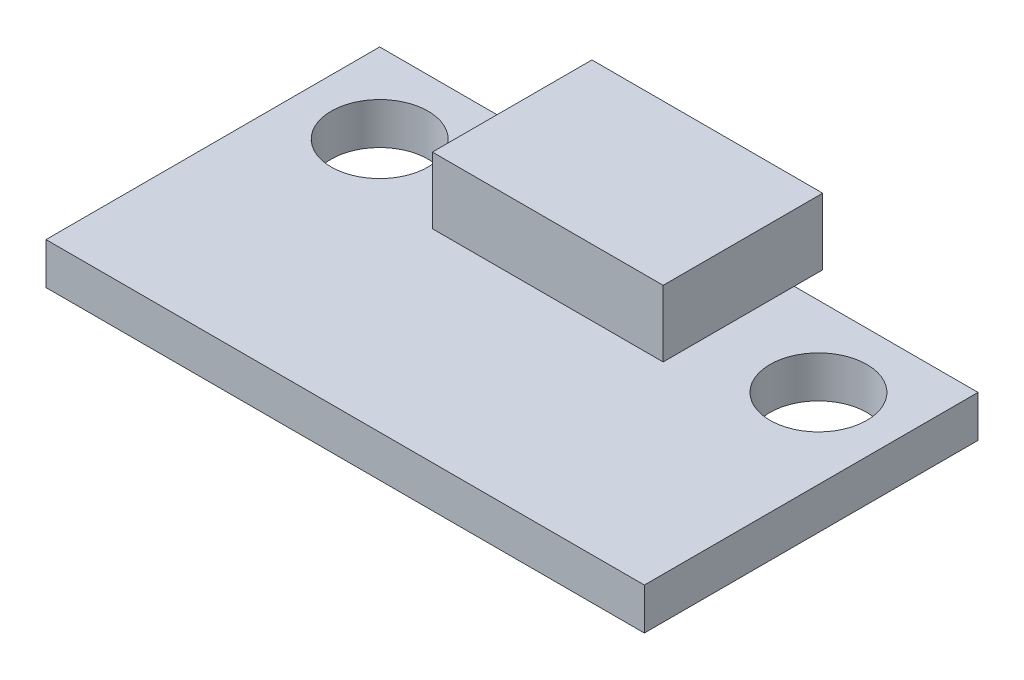
from build123d import *

# Parameters (mm, degrees)
SKETCH1_W           = 21
SKETCH1_H           = 11.71
SKETCH1_R           = 1.7
BOSS_EXTRUDE1_DEPTH = 1.46
SKETCH2_W           = 8.1
SKETCH2_H           = 5.6
BOSS_EXTRUDE2_DEPTH = 2.33


with BuildPart() as part:
    # Sketch1 → Boss-Extrude1 (new body)
    with BuildSketch(Plane(origin=(0, 0, 0), x_dir=(1, 0, 0), z_dir=(0, 1, 0))):
        Rectangle(SKETCH1_W, SKETCH1_H)
        with Locations(Location((-7.7, 3.055, 0), (0, 0, 270))):
            Circle(SKETCH1_R, mode=Mode.SUBTRACT)
        with Locations(Location((7.7, 3.055, 0), (0, 0, 90))):
            Circle(SKETCH1_R, mode=Mode.SUBTRACT)
    extrude(amount=BOSS_EXTRUDE1_DEPTH)

    # Sketch2 → Boss-Extrude2 (add)
    with BuildSketch(Plane(origin=(0, 1.46, 0), x_dir=(1, 0, 0), z_dir=(0, 1, 0))):
        with Locations((0, 4.055)):
            Rectangle(SKETCH2_W, SKETCH2_H)
    extrude(amount=BOSS_EXTRUDE2_DEPTH)


solid = part.part
